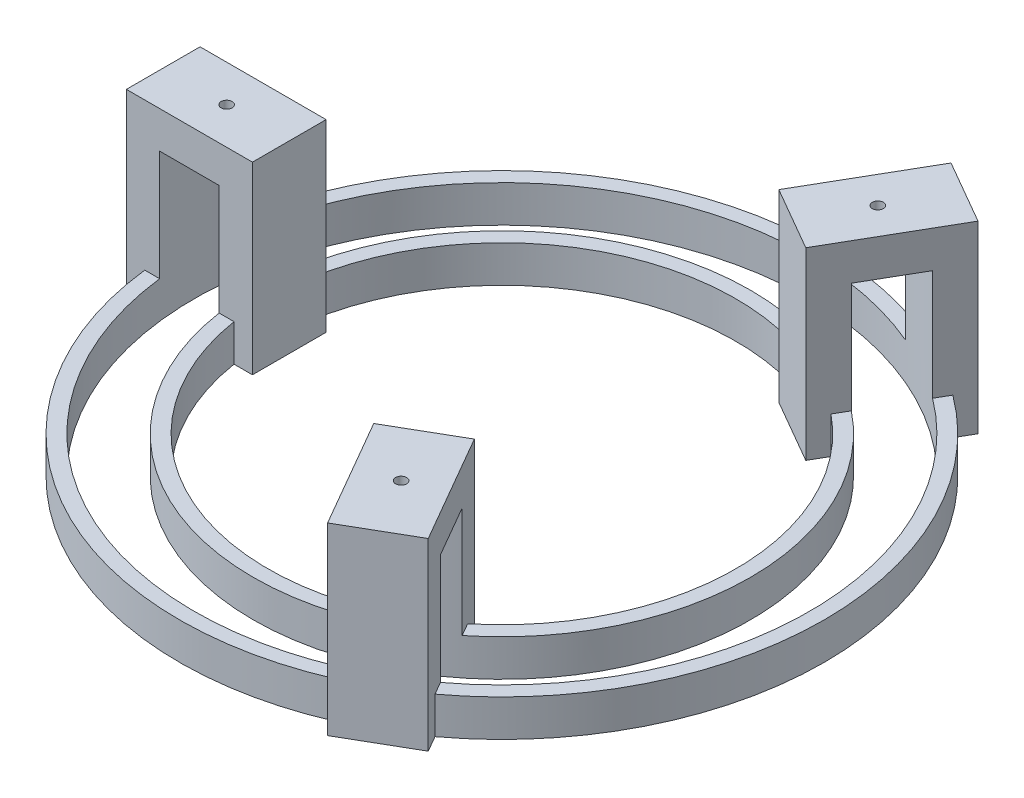
from build123d import *
from build123d.topology import SkipClean

# Parameters (mm, degrees)
IZIM1_R                       = 83.5
Y_KSEKLIK_EKSTR_ZYON3_DEPTH   = 10
IZIM1_R_2                     = 67.5
Y_KSEKLIK_EKSTR_ZYON3_2_DEPTH = 10
Y_KSEKLIK_EKSTR_ZYON6_DEPTH   = 30
Y_KSEKLIK_EKSTR_ZYON7_START   = 30
IZIM2_4_W                     = 34.219038219
IZIM2_4_H                     = 20
Y_KSEKLIK_EKSTR_ZYON7_DEPTH   = 10
IZIM3_R                       = 1.5
KES_EKSTR_ZYON1_DEPTH         = 20


with BuildPart() as part:
    # Çizim1 → Yükseklik-Ekstrüzyon3 (new body)
    with BuildSketch(Plane(origin=(0, 0, 0), x_dir=(1, 0, 0), z_dir=(0, 1, 0))):
        with BuildLine():
            Line((-91.926693254, 10), (-91.926693254, -10))
            Line((-91.926693254, -10), (-86.926693254, -10))
            ThreePointArc((-86.926693254, -10), (-43.75, -75.777222831), (34.803092589, -80.280724625))
            Line((34.803092589, -80.280724625), (37.303092589, -84.610851643))
            Line((37.303092589, -84.610851643), (54.623600665, -74.610851643))
            Line((54.623600665, -74.610851643), (52.123600665, -70.280724625))
            ThreePointArc((52.123600665, -70.280724625), (87.5, 0), (52.123600665, 70.280724625))
            Line((52.123600665, 70.280724625), (54.623600665, 74.610851643))
            Line((54.623600665, 74.610851643), (37.303092589, 84.610851643))
            Line((37.303092589, 84.610851643), (34.803092589, 80.280724625))
            ThreePointArc((34.803092589, 80.280724625), (-43.75, 75.777222831), (-86.926693254, 10))
            Line((-86.926693254, 10), (-91.926693254, 10))
        make_face()
        Circle(IZIM1_R, mode=Mode.SUBTRACT)
    extrude(amount=Y_KSEKLIK_EKSTR_ZYON3_DEPTH)



with BuildPart() as body_2:
    # Çizim1 → Y_kseklik-Ekstr_zyon3 2 (new body)
    with BuildSketch(Plane(origin=(0, 0, 0), x_dir=(1, 0, 0), z_dir=(0, 1, 0))):
        Circle(IZIM1_R_2)
        with BuildLine():
            Line((-57.707655035, 10), (-62.707655035, 10))
            ThreePointArc((-62.707655035, 10), (-31.75, 54.99261314), (22.69357348, 59.306422272))
            Line((22.69357348, 59.306422272), (20.19357348, 54.976295253))
            Line((20.19357348, 54.976295253), (37.514081555, 44.976295253))
            Line((37.514081555, 44.976295253), (40.014081555, 49.306422272))
            ThreePointArc((40.014081555, 49.306422272), (63.5, 0), (40.014081555, -49.306422272))
            Line((40.014081555, -49.306422272), (37.514081555, -44.976295253))
            Line((37.514081555, -44.976295253), (20.19357348, -54.976295253))
            Line((20.19357348, -54.976295253), (22.69357348, -59.306422272))
            ThreePointArc((22.69357348, -59.306422272), (-31.75, -54.99261314), (-62.707655035, -10))
            Line((-62.707655035, -10), (-57.707655035, -10))
            Line((-57.707655035, -10), (-57.707655035, 10))
        make_face(mode=Mode.SUBTRACT)
    extrude(amount=Y_KSEKLIK_EKSTR_ZYON3_2_DEPTH)


with BuildPart() as part_1:
    with SkipClean():  # the faces are left unmerged after this step: merging them gives an invalid solid
        add(part.part)

        add(body_2.part)  # Yükseklik-Ekstrüzyon6 merges body 2
        # Çizim2 → Yükseklik-Ekstrüzyon6 (add)
        with BuildSketch(Plane(origin=(0, 10, 0), x_dir=(1, 0, 0), z_dir=(0, 1, 0))):
            with BuildLine():
                Line((-57.707655035, -10), (-57.707655035, 10))
                Line((-57.707655035, 10), (-66.755149614, 10))
                ThreePointArc((-66.755149614, 10), (-67.5, 0), (-66.755149614, -10))
                Line((-66.755149614, -10), (-57.707655035, -10))
            make_face()
            with BuildLine():
                ThreePointArc((-82.899034976, -10), (-83.5, 0), (-82.899034976, 10))
                Line((-82.899034976, 10), (-91.926693254, 10))
                Line((-91.926693254, 10), (-91.926693254, -10))
                Line((-91.926693254, -10), (-82.899034976, -10))
            make_face()
            with BuildLine():
                ThreePointArc((42.037828845, 52.811655399), (33.75, 58.456714755), (24.717320769, 62.811655399))
                Line((24.717320769, 62.811655399), (20.19357348, 54.976295253))
                Line((20.19357348, 54.976295253), (37.514081555, 44.976295253))
                Line((37.514081555, 44.976295253), (42.037828845, 52.811655399))
            make_face()
            with BuildLine():
                Line((20.19357348, -54.976295253), (24.717320769, -62.811655399))
                ThreePointArc((24.717320769, -62.811655399), (33.75, -58.456714755), (42.037828845, -52.811655399))
                Line((42.037828845, -52.811655399), (37.514081555, -44.976295253))
                Line((37.514081555, -44.976295253), (20.19357348, -54.976295253))
            make_face()
            with BuildLine():
                Line((37.303092589, 84.610851643), (32.78926345, 76.792670239))
                ThreePointArc((32.78926345, 76.792670239), (41.75, 72.313121216), (50.109771526, 66.792670239))
                Line((50.109771526, 66.792670239), (54.623600665, 74.610851643))
                Line((54.623600665, 74.610851643), (37.303092589, 84.610851643))
            make_face()
            with BuildLine():
                ThreePointArc((50.109771526, -66.792670239), (41.75, -72.313121216), (32.78926345, -76.792670239))
                Line((32.78926345, -76.792670239), (37.303092589, -84.610851643))
                Line((37.303092589, -84.610851643), (54.623600665, -74.610851643))
                Line((54.623600665, -74.610851643), (50.109771526, -66.792670239))
            make_face()
        extrude(amount=Y_KSEKLIK_EKSTR_ZYON6_DEPTH)

    # Çizim2<4> → Yükseklik-Ekstrüzyon7 (add)
    with BuildSketch(Plane(origin=(0, 10, 0), x_dir=(1, 0, 0), z_dir=(0, 1, 0)).offset(Y_KSEKLIK_EKSTR_ZYON7_START)):
        with Locations((-74.817174145, 0)):
            Rectangle(IZIM2_4_W, IZIM2_4_H)
        Polygon((54.623600665, 74.610851643), (37.303092589, 84.610851643), (20.19357348, 54.976295253), (37.514081555, 44.976295253), align=None)
        Polygon((37.514081555, -44.976295253), (20.19357348, -54.976295253), (37.303092589, -84.610851643), (54.623600665, -74.610851643), align=None)
    extrude(amount=Y_KSEKLIK_EKSTR_ZYON7_DEPTH)

    # Çizim3 → Kes-Ekstrüzyon1 (cut)
    with SkipClean():  # the faces are left unmerged after this step: merging them gives an invalid solid
        with BuildSketch(Plane(origin=(0, 50, 0), x_dir=(1, 0, 0), z_dir=(0, 1, 0))):
            with Locations((-74.707655035, 0)):
                Circle(IZIM3_R)
            with Locations((37.353827518, 64.698727118)):
                Circle(IZIM3_R)
            with Locations((37.353827518, -64.698727118)):
                Circle(IZIM3_R)
        extrude(amount=-KES_EKSTR_ZYON1_DEPTH, mode=Mode.SUBTRACT)


solid = part_1.part
